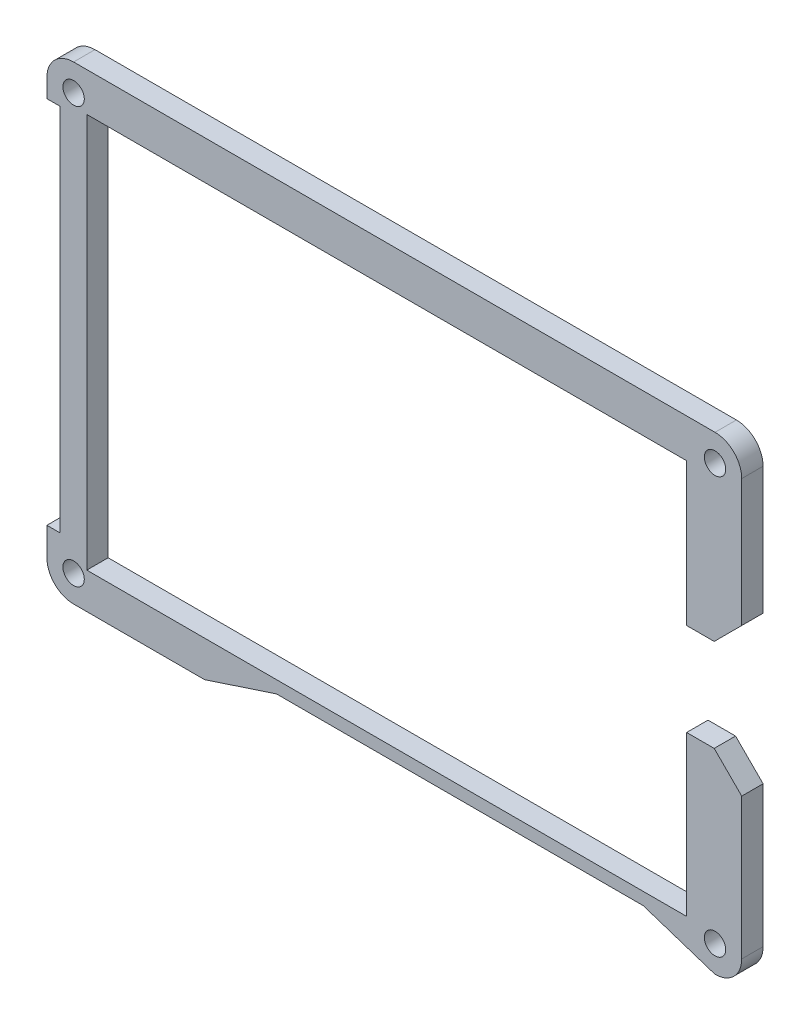
from build123d import *

# Parameters (mm, degrees)
SKETCH1_R           = 1.3462
SKETCH1_W           = 3.7846
SKETCH1_H           = 52.6961
BOSS_EXTRUDE1_DEPTH = 3.048
SKETCH2_R           = 1.524
CUT_EXTRUDE1_DEPTH  = 430.898988368


with BuildPart() as part:
    # Sketch1 → Boss-Extrude1 (new body)
    # profile 1 of 3: a face of its own
    with BuildSketch(Plane.XY):
        with BuildLine():
            Line((-401.0571, 150.956597849), (-401.0571, 148.341))
            Line((-401.0571, 148.341), (-399.1521, 148.341))
            Line((-399.1521, 148.341), (-395.3675, 148.341))
            Line((-395.3675, 148.341), (-395.3675, 149.2432))
            Line((-395.3675, 149.2432), (-309.8086, 149.2432))
            Line((-309.8086, 149.2432), (-309.8086, 128.8851))
            Line((-309.8086, 128.8851), (-305.87795, 128.8851))
            Line((-305.87795, 128.8851), (-301.9473, 132.81575))
            Line((-301.9473, 132.81575), (-301.9473, 150.9704))
            ThreePointArc((-301.9473, 150.9704), (-303.063223164, 153.664476836), (-305.7573, 154.7804))
            Line((-305.7573, 154.7804), (-397.247125, 154.7804))
            ThreePointArc((-397.247125, 154.7804), (-399.946077222, 153.659592612), (-401.0571, 150.956597849))
        make_face()
        with Locations(Location((-397.247125, 150.9704, 0), (0, 0, 180))):
            Circle(SKETCH1_R, mode=Mode.SUBTRACT)
        with Locations(Location((-305.7573, 150.9704, 0), (0, 0, 180))):
            Circle(SKETCH1_R, mode=Mode.SUBTRACT)
    # profile 2 of 3: a face of its own
    with BuildSketch(Plane.XY):
        with Locations((-397.2598, 121.99295)):
            Rectangle(SKETCH1_W, SKETCH1_H)
    # profile 3 of 3: a face of its own
    with BuildSketch(Plane.XY):
        with BuildLine():
            Line((-395.3675, 95.6449), (-399.1521, 95.6449))
            Line((-399.1521, 95.6449), (-401.0571, 95.6449))
            Line((-401.0571, 95.6449), (-401.0571, 91.659304166))
            ThreePointArc((-401.0571, 91.659304166), (-399.951018769, 88.947400452), (-397.2472, 87.8217))
            Line((-397.2472, 87.8217), (-378.5565, 87.8217))
            Line((-378.5565, 87.8217), (-368.3165, 91.1883))
            Line((-368.3165, 91.1883), (-315.9973, 91.1883))
            Line((-315.9973, 91.1883), (-305.7573, 87.8217))
            ThreePointArc((-305.7573, 87.8217), (-303.063223164, 88.937623164), (-301.9473, 91.6317))
            Line((-301.9473, 91.6317), (-301.9473, 111.74645))
            Line((-301.9473, 111.74645), (-305.87795, 115.6771))
            Line((-305.87795, 115.6771), (-309.8086, 115.6771))
            Line((-309.8086, 115.6771), (-309.8086, 92.9525))
            Line((-309.8086, 92.9525), (-395.3675, 92.9525))
            Line((-395.3675, 92.9525), (-395.3675, 95.6449))
        make_face()
        with Locations(Location((-397.2472, 91.6317, 0), (0, 0, 180))):
            Circle(SKETCH1_R, mode=Mode.SUBTRACT)
        with Locations(Location((-305.7573, 91.6317, 0), (0, 0, 180))):
            Circle(SKETCH1_R, mode=Mode.SUBTRACT)
    extrude(amount=BOSS_EXTRUDE1_DEPTH)

    # Sketch2 → Cut-Extrude1 (cut, through all)
    with BuildSketch(Plane(origin=(0, 0, 0), x_dir=(-1, 0, 0), z_dir=(0, 0, -1))):
        with Locations((305.7573, 150.9704)):
            Circle(SKETCH2_R)
        with Locations((305.7573, 91.6317)):
            Circle(SKETCH2_R)
        with Locations((397.2472, 91.6317)):
            Circle(SKETCH2_R)
        with Locations((397.247125, 150.9704)):
            Circle(SKETCH2_R)
    extrude(amount=-CUT_EXTRUDE1_DEPTH, mode=Mode.SUBTRACT)


solid = part.part
